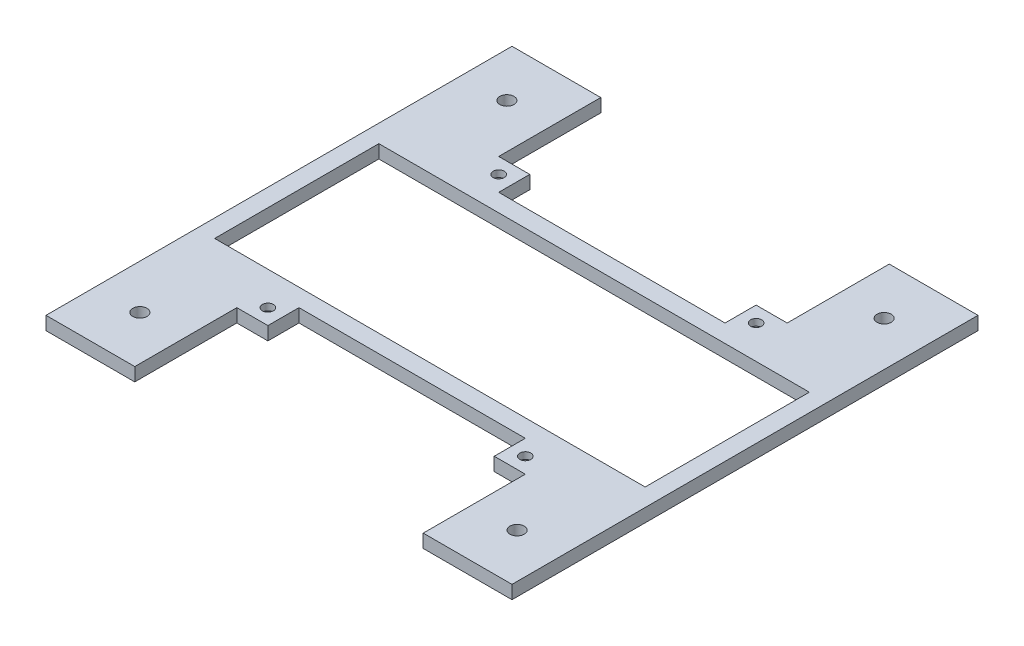
from build123d import *

# Parameters (mm, degrees)
SKETCH_1_W          = 20
SKETCH_1_H          = 105
SKETCH_1_W_2        = 65
SKETCH_1_H_2        = 45
SKETCH_1_W_3        = 7
SKETCH_1_H_3        = 59
EXTRUDE_2_DEPTH     = 3
SKETCH_1_5_W        = 97
SKETCH_1_5_H        = 37
CUT_EXTRUDE_1_DEPTH = 126.584632818
SKETCH_1_6_R        = 1.25
SKETCH_1_6_R_2      = 1.6
CUT_EXTRUDE_3_DEPTH = 126.584632818
SKETCH_1_7_R        = 2
CUT_EXTRUDE_4_DEPTH = 1.5


with BuildPart() as part:
    # 草图1 → 凸台-拉伸2 (new body)
    with BuildSketch(Plane(origin=(0, 0, 0), x_dir=(1, 0, 0), z_dir=(0, 1, 0))):
        with Locations((7.5, -20)):
            Rectangle(SKETCH_1_W, SKETCH_1_H)
        with Locations((92.5, -20)):
            Rectangle(SKETCH_1_W, SKETCH_1_H)
        with Locations((50, -20)):
            Rectangle(SKETCH_1_W_2, SKETCH_1_H_2)
        with Locations((21, -20)):
            Rectangle(SKETCH_1_W_3, SKETCH_1_H_3)
        with Locations((79, -20)):
            Rectangle(SKETCH_1_W_3, SKETCH_1_H_3)
    extrude(amount=EXTRUDE_2_DEPTH)

    # 草图1<5> → 切除-拉伸1 (cut, through all)
    with BuildSketch(Plane(origin=(0, 0, 0), x_dir=(1, 0, 0), z_dir=(0, 1, 0))):
        with Locations((50, -20)):
            Rectangle(SKETCH_1_5_W, SKETCH_1_5_H)
    extrude(amount=CUT_EXTRUDE_1_DEPTH, mode=Mode.SUBTRACT)

    # 草图1<6> → 切除-拉伸3 (cut, through all)
    with BuildSketch(Plane(origin=(0, 0, 0), x_dir=(1, 0, 0), z_dir=(0, 1, 0))):
        with Locations((21, 6)):
            Circle(SKETCH_1_6_R)
        with Locations((79, 6)):
            Circle(SKETCH_1_6_R)
        with Locations((79, -46)):
            Circle(SKETCH_1_6_R)
        with Locations((21, -46)):
            Circle(SKETCH_1_6_R)
        with Locations((7.5, 21.35)):
            Circle(SKETCH_1_6_R_2)
        with Locations((92.5, 21.35)):
            Circle(SKETCH_1_6_R_2)
        with Locations((92.5, -61.35)):
            Circle(SKETCH_1_6_R_2)
        with Locations((7.5, -61.35)):
            Circle(SKETCH_1_6_R_2)
    extrude(amount=CUT_EXTRUDE_3_DEPTH, mode=Mode.SUBTRACT)

    # 草图1<7> → 切除-拉伸4 (cut)
    with BuildSketch(Plane(origin=(0, 0, 0), x_dir=(1, 0, 0), z_dir=(0, 1, 0))):
        with Locations((21, 6)):
            Circle(SKETCH_1_7_R)
        with Locations((79, 6)):
            Circle(SKETCH_1_7_R)
        with Locations((79, -46)):
            Circle(SKETCH_1_7_R)
        with Locations((21, -46)):
            Circle(SKETCH_1_7_R)
    extrude(amount=CUT_EXTRUDE_4_DEPTH, mode=Mode.SUBTRACT)


solid = part.part
